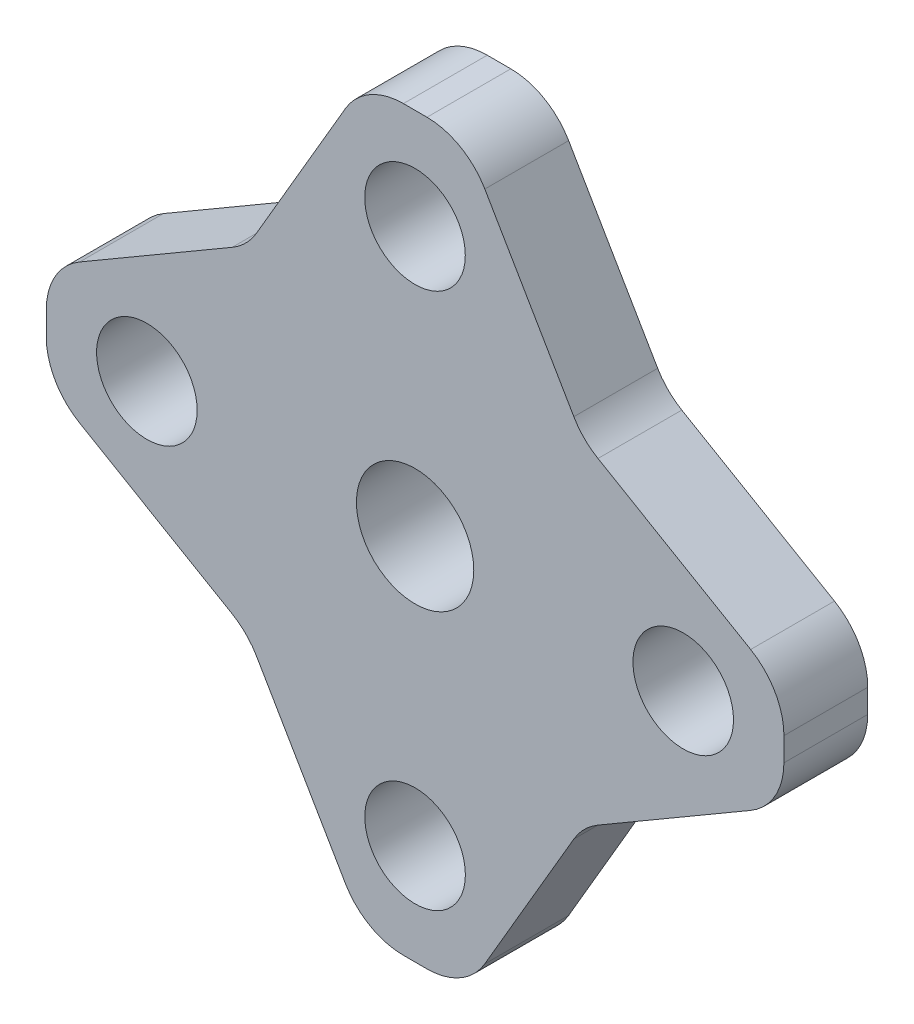
from build123d import *

# Parameters (mm, degrees)
BOSS_EXTRUDE1_DEPTH = 2.5
CUT_EXTRUDE1_DEPTH  = 2.5
SKETCH3_R           = 1.75
CUT_EXTRUDE2_DEPTH  = 2.5
FILLET1_R           = 2


with BuildPart() as part:
    # Sketch1 → Boss-Extrude1 (new body)
    with BuildSketch(Plane.XY):
        with BuildLine():
            Line((-5, 6.244997998), (-5, 7.5))
            Line((-5, 7.5), (-10.998080575, 1.501919425))
            Line((-10.998080575, 1.501919425), (-11.001951051, -1.498048949))
            Line((-11.001951051, -1.498048949), (-5, -7.5))
            Line((-5, -7.5), (-5, -6.244997998))
            ThreePointArc((-5, -6.244997998), (-6.854583671, -4.124885779), (-7.859375, -1.493393655))
            ThreePointArc((-7.859375, -1.493393655), (-9.5, 0), (-7.859375, 1.493393655))
            ThreePointArc((-7.859375, 1.493393655), (-6.854583671, 4.124885779), (-5, 6.244997998))
        make_face()
        with BuildLine():
            Line((0, 9.499997384), (0, 11.00001831))
            Line((0, 11.00001831), (-1.498048949, 11.001951051))
            Line((-1.498048949, 11.001951051), (-5, 7.5))
            Line((-5, 7.5), (-5, 6.244997998))
            ThreePointArc((-5, 6.244997998), (-3.346805661, 7.266284599), (-1.496145717, 7.85885157))
            ThreePointArc((-1.496145717, 7.85885157), (-1.111300148, 9.010559559), (0, 9.499997384))
        make_face()
        with BuildLine():
            Line((1.501919425, 10.998080575), (0, 11.00001831))
            Line((0, 11.00001831), (0, 9.499997384))
            ThreePointArc((0, 9.499997384), (1.058848726, 9.059669249), (1.497198557, 8))
            ThreePointArc((1.497198557, 8), (1.495558351, 7.929872059), (1.490641319, 7.859897484))
            ThreePointArc((1.490641319, 7.859897484), (3.344260945, 7.267456139), (5, 6.244997998))
            Line((5, 6.244997998), (5, 7.5))
            Line((5, 7.5), (1.501919425, 10.998080575))
        make_face()
        with BuildLine():
            Line((11.001951051, 1.498048949), (5, 7.5))
            Line((5, 7.5), (5, 6.244997998))
            ThreePointArc((5, 6.244997998), (6.853793729, 4.126198193), (7.858802525, 1.496403311))
            ThreePointArc((7.858802525, 1.496403311), (9.007744437, 1.111312618), (9.497198557, 0.002801443))
            ThreePointArc((9.497198557, 0.002801443), (9.00813269, -1.105355666), (7.859848986, -1.490897019))
            ThreePointArc((7.859848986, -1.490897019), (6.855238728, -4.123797035), (5, -6.244997998))
            Line((5, -6.244997998), (5, -7.5))
            Line((5, -7.5), (10.998080575, -1.501919425))
            Line((10.998080575, -1.501919425), (11.001951051, 1.498048949))
        make_face()
        with BuildLine():
            ThreePointArc((-1.493650301, -7.859326229), (-3.345652024, -7.266815846), (-5, -6.244997998))
            Line((-5, -6.244997998), (-5, -7.5))
            Line((-5, -7.5), (-1.501919425, -10.998080575))
            Line((-1.501919425, -10.998080575), (0, -11.00001831))
            Line((0, -11.00001831), (0, -9.497198557))
            ThreePointArc((0, -9.497198557), (-1.108333995, -9.007938758), (-1.493650301, -7.859326229))
        make_face()
        with BuildLine():
            Line((5, -7.5), (5, -6.244997998))
            ThreePointArc((5, -6.244997998), (3.345652024, -7.266815846), (1.493650301, -7.859326229))
            ThreePointArc((1.493650301, -7.859326229), (1.498411734, -7.928189323), (1.5, -7.997198557))
            ThreePointArc((1.5, -7.997198557), (1.060660172, -9.057858728), (0, -9.497198557))
            Line((0, -9.497198557), (0, -11.00001831))
            Line((0, -11.00001831), (1.498048949, -11.001951051))
            Line((1.498048949, -11.001951051), (5, -7.5))
        make_face()
        with BuildLine():
            ThreePointArc((0, 6.500002616), (-1.011288975, 6.889615878), (-1.496145717, 7.85885157))
            ThreePointArc((-1.496145717, 7.85885157), (-3.346805661, 7.266284599), (-5, 6.244997998))
            Line((-5, 6.244997998), (-5, -6.244997998))
            ThreePointArc((-5, -6.244997998), (-3.345652024, -7.266815846), (-1.493650301, -7.859326229))
            ThreePointArc((-1.493650301, -7.859326229), (-1.010740201, -6.888864561), (0, -6.497198557))
            Line((0, -6.497198557), (0, 6.500002616))
        make_face()
        with BuildLine():
            Line((-5, -6.244997998), (-5, 6.244997998))
            ThreePointArc((-5, 6.244997998), (-6.854583671, 4.124885779), (-7.859375, 1.493393655))
            ThreePointArc((-7.859375, 1.493393655), (-6.890735041, 1.009718401), (-6.5, 0))
            ThreePointArc((-6.5, 0), (-6.890735041, -1.009718401), (-7.859375, -1.493393655))
            ThreePointArc((-7.859375, -1.493393655), (-6.854583671, -4.124885779), (-5, -6.244997998))
        make_face()
        with BuildLine():
            Line((5, -6.244997998), (5, 6.244997998))
            ThreePointArc((5, 6.244997998), (3.344260945, 7.267456139), (1.490641319, 7.859897484))
            ThreePointArc((1.490641319, 7.859897484), (1.008146228, 6.891855241), (0, 6.500002616))
            Line((0, 6.500002616), (0, -6.497198557))
            ThreePointArc((0, -6.497198557), (1.010740201, -6.888864561), (1.493650301, -7.859326229))
            ThreePointArc((1.493650301, -7.859326229), (3.345652024, -7.266815846), (5, -6.244997998))
        make_face()
        with BuildLine():
            ThreePointArc((7.858802525, 1.496403311), (6.853793729, 4.126198193), (5, 6.244997998))
            Line((5, 6.244997998), (5, -6.244997998))
            ThreePointArc((5, -6.244997998), (6.855238728, -4.123797035), (7.859848986, -1.490897019))
            ThreePointArc((7.859848986, -1.490897019), (6.497198649, 0.002275989), (7.858802525, 1.496403311))
        make_face()
    extrude(amount=BOSS_EXTRUDE1_DEPTH)

    # Sketch2 → Cut-Extrude1 (cut)
    with BuildSketch(Plane.XY.offset(2.5)):
        Polygon((-5, 5), (-10.998080575, 1.501919425), (-1.498048949, 11.001951051), align=None)
        Polygon((-5, -5), (-1.501919425, -10.998080575), (-11.001951051, -1.498048949), align=None)
        Polygon((1.501919425, 10.998080575), (5, 5), (11.001951051, 1.498048949), align=None)
        Polygon((10.998080575, -1.501919425), (5, -5), (1.498048949, -11.001951051), align=None)
    extrude(amount=-CUT_EXTRUDE1_DEPTH, mode=Mode.SUBTRACT)

    # Sketch3 → Cut-Extrude2 (cut)
    with BuildSketch(Plane.XY.offset(2.5)):
        Circle(SKETCH3_R)
    extrude(amount=-CUT_EXTRUDE2_DEPTH, mode=Mode.SUBTRACT)

    # Fillet1
    fillet1_edges = [part.edges().sort_by_distance(p)[0] for p in [
        (1.498048949, -11.001951051, 1.25),
        (-1.501919425, -10.998080575, 1.25),
        (-11.001951051, -1.498048949, 1.25),
        (-10.998080575, 1.501919425, 1.25),
        (-1.498048949, 11.001951051, 1.25),
        (1.501919425, 10.998080575, 1.25),
        (11.001951051, 1.498048949, 1.25),
        (10.998080575, -1.501919425, 1.25),
        (-5, -5, 1.25),
        (5, 5, 1.25),
        (5, -5, 1.25),
        (-5, 5, 1.25),
    ]]
    fillet(fillet1_edges, radius=FILLET1_R)


solid = part.part
